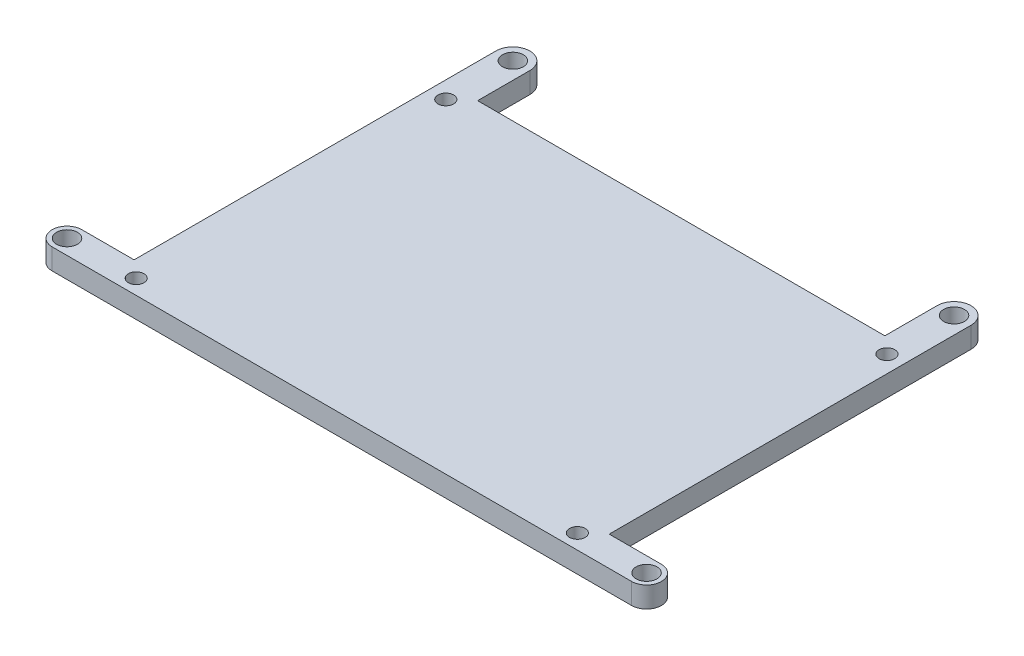
from build123d import *

# Parameters (mm, degrees)
SKETCH1_R           = 1.5
SKETCH1_R_2         = 2
BOSS_EXTRUDE1_DEPTH = 2


with BuildPart() as part:
    # Sketch1 → Boss-Extrude1 (new, symmetric)
    with BuildSketch(Plane(origin=(0, 0, 0), x_dir=(1, 0, 0), z_dir=(0, 1, 0))):
        with BuildLine():
            Line((-45.5, 32.5), (-45.5, -26.8))
            Line((-45.5, -26.8), (-55.5, -26.8))
            ThreePointArc((-55.5, -26.8), (-58.35, -29.65), (-55.5, -32.5))
            Line((-55.5, -32.5), (-45.5, -32.5))
            Line((-45.5, -32.5), (45.5, -32.5))
            Line((45.5, -32.5), (55.5, -32.5))
            ThreePointArc((55.5, -32.5), (58.35, -29.65), (55.5, -26.8))
            Line((55.5, -26.8), (45.5, -26.8))
            Line((45.5, -26.8), (45.5, 32.5))
            Line((45.5, 32.5), (45.5, 42.5))
            ThreePointArc((45.5, 42.5), (42.25, 45.75), (39, 42.5))
            Line((39, 42.5), (39, 32.5))
            Line((39, 32.5), (-39, 32.5))
            Line((-39, 32.5), (-39, 42.5))
            ThreePointArc((-39, 42.5), (-42.25, 45.75), (-45.5, 42.5))
            Line((-45.5, 42.5), (-45.5, 32.5))
        make_face()
        with Locations(Location((-42.25, 29.65, 0), (0, 0, 270))):
            Circle(SKETCH1_R, mode=Mode.SUBTRACT)
        with Locations(Location((42.25, 29.65, 0), (0, 0, 270))):
            Circle(SKETCH1_R, mode=Mode.SUBTRACT)
        with Locations(Location((42.25, -29.65, 0), (0, 0, 270))):
            Circle(SKETCH1_R, mode=Mode.SUBTRACT)
        with Locations(Location((-42.25, -29.65, 0), (0, 0, 270))):
            Circle(SKETCH1_R, mode=Mode.SUBTRACT)
        with Locations(Location((-42.25, 42.5, 0), (0, 0, 270))):
            Circle(SKETCH1_R_2, mode=Mode.SUBTRACT)
        with Locations(Location((42.25, 42.5, 0), (0, 0, 270))):
            Circle(SKETCH1_R_2, mode=Mode.SUBTRACT)
        with Locations(Location((-55.5, -29.65, 0), (0, 0, 270))):
            Circle(SKETCH1_R_2, mode=Mode.SUBTRACT)
        with Locations(Location((55.5, -29.65, 0), (0, 0, 270))):
            Circle(SKETCH1_R_2, mode=Mode.SUBTRACT)
    extrude(amount=BOSS_EXTRUDE1_DEPTH, both=True)


solid = part.part
